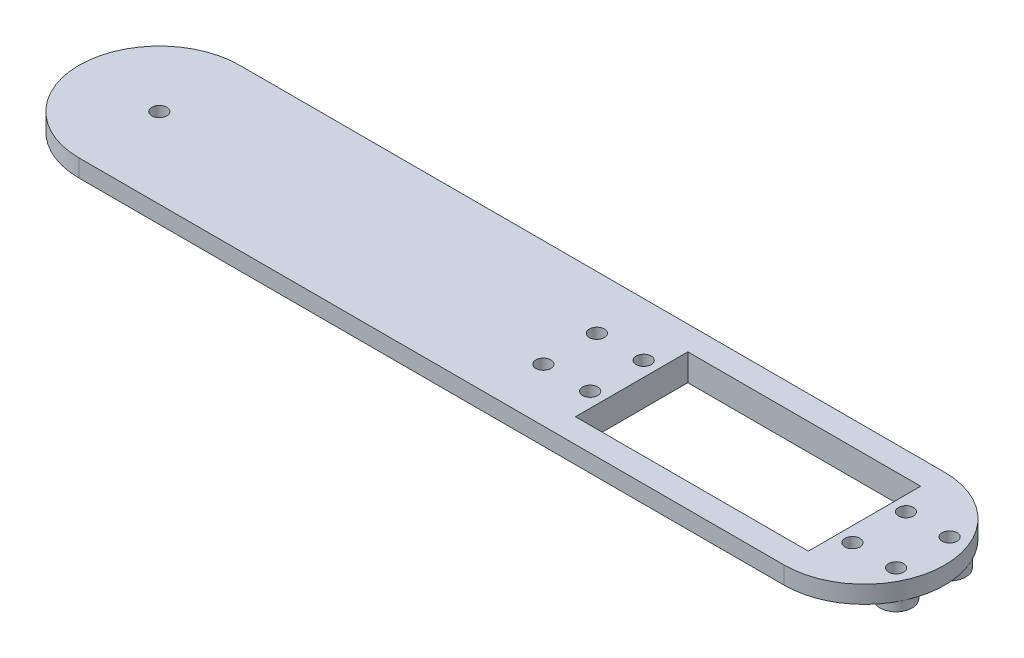
from build123d import *

# Parameters (mm, degrees)
SKETCH1_R           = 1.4
SKETCH1_W           = 43.5
SKETCH1_H           = 21
BOSS_EXTRUDE1_DEPTH = 5
CHAMFER1_SIZE       = 3
CHAMFER1_SIZE2      = 1.732050808
SKETCH3_R           = 1.4
CUT_EXTRUDE2_DEPTH  = 148.599330961
SKETCH5_R           = 3
BOSS_EXTRUDE2_DEPTH = 5
SKETCH6_R           = 1.4
CUT_EXTRUDE3_DEPTH  = 148.59933107


with BuildPart() as part:
    # Sketch1 → Boss-Extrude1 (new body)
    with BuildSketch(Plane(origin=(0, 0, 0), x_dir=(1, 0, 0), z_dir=(0, 1, 0))):
        with BuildLine():
            Line((0, 15), (131.75, 15))
            ThreePointArc((131.75, 15), (146.75, 0), (131.75, -15))
            Line((131.75, -15), (0, -15))
            ThreePointArc((0, -15), (-15, 0), (0, 15))
        make_face()
        Circle(SKETCH1_R, mode=Mode.SUBTRACT)
        with Locations((85.5, 5)):
            Circle(SKETCH1_R, mode=Mode.SUBTRACT)
        with Locations((85.5, -5)):
            Circle(SKETCH1_R, mode=Mode.SUBTRACT)
        with Locations((134.5, -5)):
            Circle(SKETCH1_R, mode=Mode.SUBTRACT)
        with Locations((134.5, 5)):
            Circle(SKETCH1_R, mode=Mode.SUBTRACT)
        with Locations((110, 0)):
            Rectangle(SKETCH1_W, SKETCH1_H, mode=Mode.SUBTRACT)
    extrude(amount=BOSS_EXTRUDE1_DEPTH)

    # Chamfer1
    chamfer1_edges = [part.edges().sort_by_distance(p)[0] for p in [
        (-15, 0, 0),
        (65.875, 0, -15),
        (146.75, 0, 0),
        (65.875, 0, 15),
    ]]
    chamfer1_side = [part.faces().sort_by_distance(p)[0] for p in [
        (54.841734093, 0, 0),
    ]]
    chamfer(chamfer1_edges, length=CHAMFER1_SIZE, length2=CHAMFER1_SIZE2, reference=chamfer1_side[0])

    # Sketch3 → Cut-Extrude2 (cut, through all)
    with BuildSketch(Plane.XZ):
        with Locations((76.75, 5)):
            Circle(SKETCH3_R)
        with Locations((76.75, -5)):
            Circle(SKETCH3_R)
    extrude(amount=-CUT_EXTRUDE2_DEPTH, mode=Mode.SUBTRACT)

    # Sketch5 → Boss-Extrude2 (add)
    with BuildSketch(Plane.XZ):
        with Locations((142.658712115, -5)):
            Circle(SKETCH5_R)
    boss_extrude2 = extrude(amount=-BOSS_EXTRUDE2_DEPTH)

    # Sketch6 → Cut-Extrude3 (cut, through all)
    with BuildSketch(Plane.XZ):
        with Locations((142.658712115, -5)):
            Circle(SKETCH6_R)
    cut_extrude3 = extrude(amount=-CUT_EXTRUDE3_DEPTH, mode=Mode.SUBTRACT)

    # Mirror1: Boss-Extrude2, Cut-Extrude3 across plane
    add(boss_extrude2.mirror(Plane.XY))
    add(cut_extrude3.mirror(Plane.XY), mode=Mode.SUBTRACT)


solid = part.part
